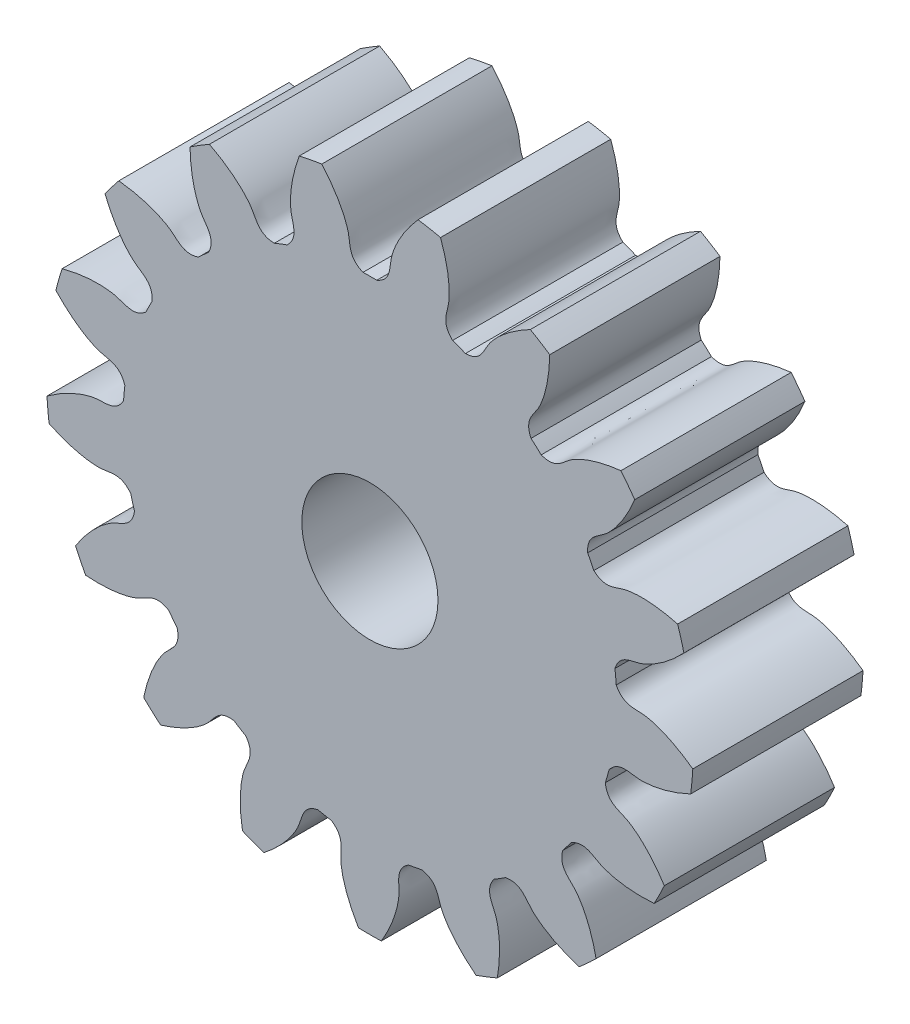
from build123d import *

# Parameters (mm, degrees)
SKETCH_1_R               = 19
EXTRUDE_1_DEPTH          = 10
CUT_EXTRUDE_1_DEPTH      = 29.670542374
PATTERN_CIRCULAR_1_COUNT = 17
CUT_EXTRUDE_2_REACH      = 30.65
SKETCH_4_R               = 4


with BuildPart() as part:
    # 草图1 → 凸台-拉伸1 (new body)
    with BuildSketch(Plane.XY):
        Circle(SKETCH_1_R)
    extrude(amount=EXTRUDE_1_DEPTH)

    # 草图2 → 切除-拉伸1 (cut, through all)
    with BuildSketch(Plane.XY):
        with BuildLine():
            ThreePointArc((0.403387494, 14.494387829), (0, 14.5), (-0.403387494, 14.494387829))
            add(Edge.make_bspline(
                [(-0.403387494, 14.494387829), (-1.255759481, 14.849644042), (-1.132390756, 15.509626813), (-1.276611209, 16.129648275), (-1.289951469, 16.18230119), (-1.306037005, 16.240838627), (-1.32510118, 16.305170665), (-1.347383555, 16.375198727), (-1.373118159, 16.450817515), (-1.40253689, 16.531914502), (-1.435868224, 16.618370188), (-1.473337358, 16.710058129), (-1.515165928, 16.80684504), (-1.561571855, 16.908590882), (-1.612769151, 17.015148962), (-1.66896775, 17.12636603), (-1.730373323, 17.242082389), (-1.797187111, 17.362132), (-1.869605751, 17.4863426), (-1.947821109, 17.61453582), (-2.032020115, 17.746527309), (-2.1223846, 17.882126855), (-2.219091138, 18.021138524), (-2.32231089, 18.163360791), (-2.432209452, 18.308586678), (-2.548946705, 18.456603899), (-2.67267667, 18.607195006), (-2.803547366, 18.760137539), (-2.941700674, 18.915204179), (-3.087272199, 19.072162909), (-3.24039114, 19.23077717), (-3.401180166, 19.390806026), (-3.569755292, 19.552004336), (-3.746225758, 19.71412292), (-3.930693918, 19.876908731), (-4.123255131, 20.040105038), (-4.323997649, 20.203451599), (-4.533002522, 20.366684847), (-4.750343497, 20.529538073), (-4.976086928, 20.691741613), (-5.210291694, 20.853023038), (-5.453009069, 21.013107349), (-5.79164327, 21.226861067), (-6.053153804, 21.381051942), (-6.231291666, 21.481438237)],
                knots=[0, 0, 0, 0, 0.193882922, 0.199023975, 0.204850501, 0.211362501, 0.218559975, 0.226442923, 0.235011345, 0.24426524, 0.254204608, 0.264829451, 0.276139767, 0.288135557, 0.300816821, 0.314183558, 0.328235769, 0.342973453, 0.358396612, 0.374505244, 0.39129935, 0.408778929, 0.426943982, 0.445794509, 0.46533051, 0.485551984, 0.506458932, 0.528051354, 0.550329249, 0.573292619, 0.596941461, 0.621275778, 0.646295568, 0.672000832, 0.69839157, 0.725467781, 0.753229466, 0.781676625, 0.810809257, 0.840627364, 0.871130943, 0.902319997, 0.934194524, 1, 1, 1, 1], degree=3))
            ThreePointArc((-6.231291666, 21.481438237), (0, 22.366966369), (6.231291666, 21.481438237))
            add(Edge.make_bspline(
                [(0.403387494, 14.494387829), (1.255759481, 14.849644042), (1.132390756, 15.509626813), (1.276611209, 16.129648275), (1.289951469, 16.18230119), (1.306037005, 16.240838627), (1.32510118, 16.305170665), (1.347383555, 16.375198727), (1.373118159, 16.450817515), (1.40253689, 16.531914502), (1.435868224, 16.618370188), (1.473337358, 16.710058129), (1.515165928, 16.80684504), (1.561571855, 16.908590882), (1.612769151, 17.015148962), (1.66896775, 17.12636603), (1.730373323, 17.242082389), (1.797187111, 17.362132), (1.869605751, 17.4863426), (1.947821109, 17.61453582), (2.032020115, 17.746527309), (2.1223846, 17.882126855), (2.219091138, 18.021138524), (2.32231089, 18.163360791), (2.432209452, 18.308586678), (2.548946705, 18.456603899), (2.67267667, 18.607195006), (2.803547366, 18.760137539), (2.941700674, 18.915204179), (3.087272199, 19.072162909), (3.24039114, 19.23077717), (3.401180166, 19.390806026), (3.569755292, 19.552004336), (3.746225758, 19.71412292), (3.930693918, 19.876908731), (4.123255131, 20.040105038), (4.323997649, 20.203451599), (4.533002522, 20.366684847), (4.750343497, 20.529538073), (4.976086928, 20.691741613), (5.210291694, 20.853023038), (5.453009069, 21.013107349), (5.79164327, 21.226861067), (6.053153804, 21.381051942), (6.231291666, 21.481438237)],
                knots=[0, 0, 0, 0, 0.193882922, 0.199023975, 0.204850501, 0.211362501, 0.218559975, 0.226442923, 0.235011345, 0.24426524, 0.254204608, 0.264829451, 0.276139767, 0.288135557, 0.300816821, 0.314183558, 0.328235769, 0.342973453, 0.358396612, 0.374505244, 0.39129935, 0.408778929, 0.426943982, 0.445794509, 0.46533051, 0.485551984, 0.506458932, 0.528051354, 0.550329249, 0.573292619, 0.596941461, 0.621275778, 0.646295568, 0.672000832, 0.69839157, 0.725467781, 0.753229466, 0.781676625, 0.810809257, 0.840627364, 0.871130943, 0.902319997, 0.934194524, 1, 1, 1, 1], degree=3))
        make_face()
    cut_extrude_1 = extrude(amount=CUT_EXTRUDE_1_DEPTH, mode=Mode.SUBTRACT)

    # 阵列(圆周)1: 切除-拉伸1 ×17 about axis
    pattern_circular_1_axis = Axis((0, 0, -1.5), (0, 0, 1))
    for i in range(1, PATTERN_CIRCULAR_1_COUNT):
        add(cut_extrude_1.rotate(pattern_circular_1_axis, i * 360 / PATTERN_CIRCULAR_1_COUNT), mode=Mode.SUBTRACT)

    # 草图4 → 切除-拉伸2 (cut, up to next)
    with BuildSketch(Plane.XY.offset(10), mode=Mode.PRIVATE) as cut_extrude_2_sk1:
        Circle(SKETCH_4_R)
    cut_extrude_2_tool1 = extrude(cut_extrude_2_sk1.sketch, amount=-CUT_EXTRUDE_2_REACH, mode=Mode.PRIVATE) & part.part
    add(cut_extrude_2_tool1.solids().sort_by_distance((0, 0, 10))[0], mode=Mode.SUBTRACT)


solid = part.part
